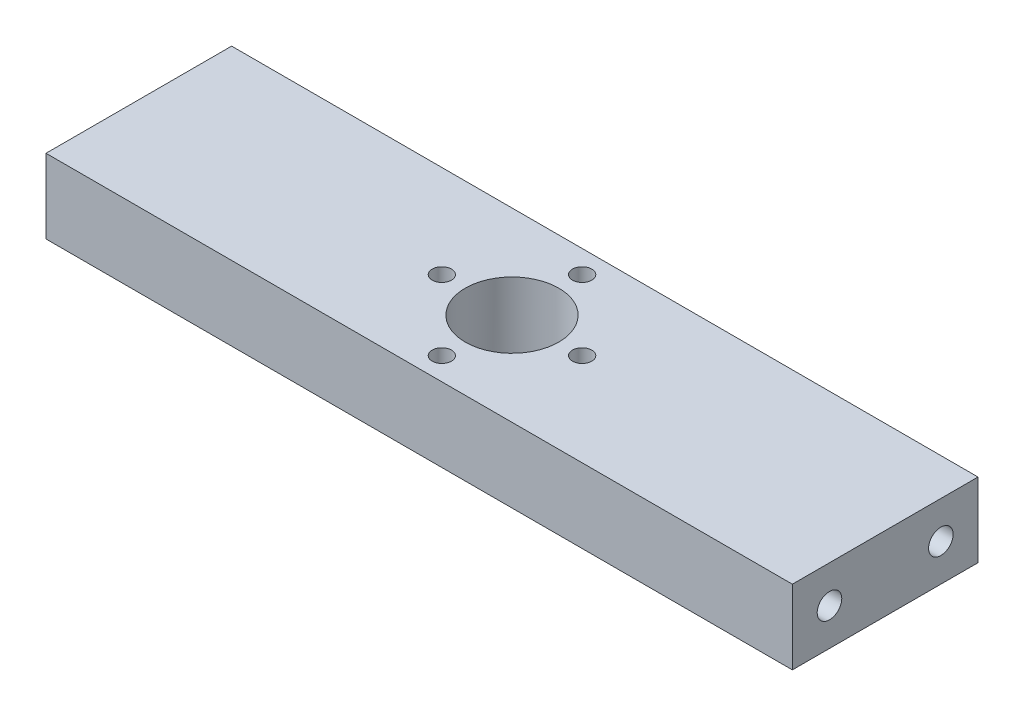
from build123d import *

# Parameters (mm, degrees)
SKETCH1_W                      = 127.660000204
SKETCH1_H                      = 31.75
BOSS_EXTRUDE1_DEPTH            = 6.35
M5X0_8_TAPPED_HOLE1_AT_2_COUNT = 2
M5X0_8_TAPPED_HOLE1_AT_2_PITCH = 19.05
F_16_0MM_DOWEL_HOLE1_D         = 16
TAP_DRILL_FOR_M4X0_7_TAP1_D    = 3.3


with BuildPart() as part:
    # Sketch1 → Boss-Extrude1 (new, symmetric)
    with BuildSketch(Plane(origin=(0, 0, 0), x_dir=(1, 0, 0), z_dir=(0, 1, 0))):
        Rectangle(SKETCH1_W, SKETCH1_H)
    extrude(amount=BOSS_EXTRUDE1_DEPTH, both=True)

    # Sketch4 → M5x0.8 Tapped Hole1 (revolve, cut)
    with BuildSketch(Plane(origin=(-63.830000102, 0, 9.525), x_dir=(0, 0, 1), z_dir=(0, 1, 0))):
        Polygon((0, 0), (0, 12.192), (2.1, 10.9301927), (2.1, 0), align=None)
    m5x0_8_tapped_hole1 = revolve(axis=Axis((-70.180000102, 0, 9.525), (1, 0, 0)), mode=Mode.SUBTRACT)

    # M5x0.8 Tapped Hole1 at 2: M5x0.8 Tapped Hole1 ×2
    with Locations(*[(0, 0, -i * M5X0_8_TAPPED_HOLE1_AT_2_PITCH) for i in range(1, M5X0_8_TAPPED_HOLE1_AT_2_COUNT)]):
        add(m5x0_8_tapped_hole1, mode=Mode.SUBTRACT)

    # Mirror1: M5x0.8 Tapped Hole1 across plane
    add(m5x0_8_tapped_hole1.mirror(Plane(origin=(0, 0, 0), x_dir=(0, 0, 1), z_dir=(1, 0, 0))), mode=Mode.SUBTRACT)

    # Mirror1 copy 1 sketch → Mirror1 copy 1 (revolve, cut)
    with BuildSketch(Plane(origin=(63.830000102, 0, -9.525), x_dir=(0, 0, 1), z_dir=(0, 1, 0))):
        Polygon((0, 0), (0, -12.192), (2.1, -10.9301927), (2.1, 0), align=None)
    revolve(axis=Axis((70.180000102, 0, -9.525), (1, 0, 0)), mode=Mode.SUBTRACT)

    # Ø16.0mm Dowel Hole1 (through all)
    with Locations(Plane(origin=(0, 6.35, 0), x_dir=(1, 0, 0), z_dir=(0, 1, 0))):
        with Locations((0, 0)):
            Hole(F_16_0MM_DOWEL_HOLE1_D / 2)

    # Tap Drill for M4x0.7 Tap1 (through all)
    with Locations(Plane(origin=(0, 6.35, 0), x_dir=(1, 0, 0), z_dir=(0, 1, 0))):
        with Locations((0, 12), (12, 0), (-12, 0), (0, -12)):
            Hole(TAP_DRILL_FOR_M4X0_7_TAP1_D / 2)


solid = part.part
